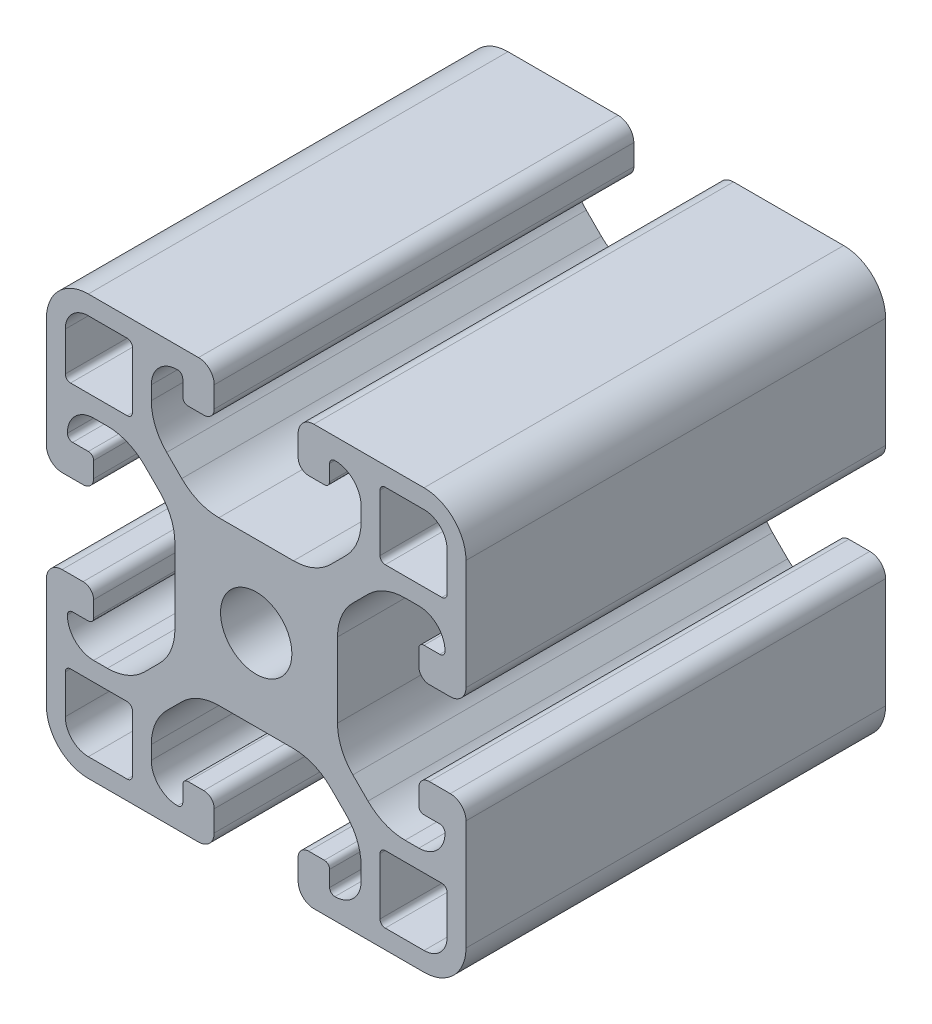
from build123d import *

# Parameters (mm, degrees)
ESQUISSE1_R        = 3.4
BOSS_EXTRU_1_DEPTH = 40


with BuildPart() as part:
    # Esquisse1 → Boss.-Extru.1 (new body)
    with BuildSketch(Plane(origin=(0, 0, -30), x_dir=(-1, 0, 0), z_dir=(0, 0, -1))):
        with BuildLine():
            Line((-4.5, 15), (-4.5, 13.5))
            ThreePointArc((-4.5, 13.5), (-4.353553391, 13.146446609), (-4, 13))
            Line((-4, 13), (-2.5, 13))
            ThreePointArc((-2.5, 13), (-2.146446609, 12.853553391), (-2, 12.5))
            ThreePointArc((-2, 12.5), (-2.732233047, 10.732233047), (-4.5, 10))
            Line((-4.5, 10), (-5.807611845, 10))
            ThreePointArc((-5.807611845, 10), (-7.721029006, 10.380602337), (-9.343145751, 11.464466094))
            Line((-9.343145751, 11.464466094), (-10.785533906, 12.906854249))
            ThreePointArc((-10.785533906, 12.906854249), (-11.869397663, 14.528970994), (-12.25, 16.442388155))
            Line((-12.25, 16.442388155), (-12.25, 23.557611845))
            ThreePointArc((-12.25, 23.557611845), (-11.869397663, 25.471029006), (-10.785533906, 27.093145751))
            Line((-10.785533906, 27.093145751), (-9.343145751, 28.535533906))
            ThreePointArc((-9.343145751, 28.535533906), (-7.721029006, 29.619397663), (-5.807611845, 30))
            Line((-5.807611845, 30), (-4.5, 30))
            ThreePointArc((-4.5, 30), (-2.732233047, 29.267766953), (-2, 27.5))
            ThreePointArc((-2, 27.5), (-2.146446609, 27.146446609), (-2.5, 27))
            Line((-2.5, 27), (-4, 27))
            ThreePointArc((-4, 27), (-4.353553391, 26.853553391), (-4.5, 26.5))
            Line((-4.5, 26.5), (-4.5, 25))
            ThreePointArc((-4.5, 25), (-4.207106781, 24.292893219), (-3.5, 24))
            Line((-3.5, 24), (-1.5, 24))
            ThreePointArc((-1.5, 24), (-0.439339828, 24.439339828), (0, 25.5))
            Line((0, 25.5), (0, 36))
            ThreePointArc((0, 36), (-1.171572875, 38.828427125), (-4, 40))
            Line((-4, 40), (-14.5, 40))
            ThreePointArc((-14.5, 40), (-15.560660172, 39.560660172), (-16, 38.5))
            Line((-16, 38.5), (-16, 36.5))
            ThreePointArc((-16, 36.5), (-15.707106781, 35.792893219), (-15, 35.5))
            Line((-15, 35.5), (-13.5, 35.5))
            ThreePointArc((-13.5, 35.5), (-13.146446609, 35.646446609), (-13, 36))
            Line((-13, 36), (-13, 37.5))
            ThreePointArc((-13, 37.5), (-12.853553391, 37.853553391), (-12.5, 38))
            ThreePointArc((-12.5, 38), (-10.732233047, 37.267766953), (-10, 35.5))
            Line((-10, 35.5), (-10, 34.192388155))
            ThreePointArc((-10, 34.192388155), (-10.380602337, 32.278970994), (-11.464466094, 30.656854249))
            Line((-11.464466094, 30.656854249), (-12.906854249, 29.214466094))
            ThreePointArc((-12.906854249, 29.214466094), (-14.528970994, 28.130602337), (-16.442388155, 27.75))
            Line((-16.442388155, 27.75), (-23.557611845, 27.75))
            ThreePointArc((-23.557611845, 27.75), (-25.471029006, 28.130602337), (-27.093145751, 29.214466094))
            Line((-27.093145751, 29.214466094), (-28.535533906, 30.656854249))
            ThreePointArc((-28.535533906, 30.656854249), (-29.619397663, 32.278970994), (-30, 34.192388155))
            Line((-30, 34.192388155), (-30, 35.5))
            ThreePointArc((-30, 35.5), (-29.267766953, 37.267766953), (-27.5, 38))
            ThreePointArc((-27.5, 38), (-27.146446609, 37.853553391), (-27, 37.5))
            Line((-27, 37.5), (-27, 36))
            ThreePointArc((-27, 36), (-26.853553391, 35.646446609), (-26.5, 35.5))
            Line((-26.5, 35.5), (-25, 35.5))
            ThreePointArc((-25, 35.5), (-24.292893219, 35.792893219), (-24, 36.5))
            Line((-24, 36.5), (-24, 38.5))
            ThreePointArc((-24, 38.5), (-24.439339828, 39.560660172), (-25.5, 40))
            Line((-25.5, 40), (-36, 40))
            ThreePointArc((-36, 40), (-38.828427125, 38.828427125), (-40, 36))
            Line((-40, 36), (-40, 25.5))
            ThreePointArc((-40, 25.5), (-39.560660172, 24.439339828), (-38.5, 24))
            Line((-38.5, 24), (-36.5, 24))
            ThreePointArc((-36.5, 24), (-35.792893219, 24.292893219), (-35.5, 25))
            Line((-35.5, 25), (-35.5, 26.5))
            ThreePointArc((-35.5, 26.5), (-35.646446609, 26.853553391), (-36, 27))
            Line((-36, 27), (-37.5, 27))
            ThreePointArc((-37.5, 27), (-37.853553391, 27.146446609), (-38, 27.5))
            ThreePointArc((-38, 27.5), (-37.267766953, 29.267766953), (-35.5, 30))
            Line((-35.5, 30), (-34.192388155, 30))
            ThreePointArc((-34.192388155, 30), (-32.278970994, 29.619397663), (-30.656854249, 28.535533906))
            Line((-30.656854249, 28.535533906), (-29.214466094, 27.093145751))
            ThreePointArc((-29.214466094, 27.093145751), (-28.130602337, 25.471029006), (-27.75, 23.557611845))
            Line((-27.75, 23.557611845), (-27.75, 16.442388155))
            ThreePointArc((-27.75, 16.442388155), (-28.130602337, 14.528970994), (-29.214466094, 12.906854249))
            Line((-29.214466094, 12.906854249), (-30.656854249, 11.464466094))
            ThreePointArc((-30.656854249, 11.464466094), (-32.278970994, 10.380602337), (-34.192388155, 10))
            Line((-34.192388155, 10), (-35.5, 10))
            ThreePointArc((-35.5, 10), (-37.267766953, 10.732233047), (-38, 12.5))
            ThreePointArc((-38, 12.5), (-37.853553391, 12.853553391), (-37.5, 13))
            Line((-37.5, 13), (-36, 13))
            ThreePointArc((-36, 13), (-35.646446609, 13.146446609), (-35.5, 13.5))
            Line((-35.5, 13.5), (-35.5, 15))
            ThreePointArc((-35.5, 15), (-35.792893219, 15.707106781), (-36.5, 16))
            Line((-36.5, 16), (-38.5, 16))
            ThreePointArc((-38.5, 16), (-39.560660172, 15.560660172), (-40, 14.5))
            Line((-40, 14.5), (-40, 4))
            ThreePointArc((-40, 4), (-38.828427125, 1.171572875), (-36, 0))
            Line((-36, 0), (-25.5, 0))
            ThreePointArc((-25.5, 0), (-24.439339828, 0.439339828), (-24, 1.5))
            Line((-24, 1.5), (-24, 3.5))
            ThreePointArc((-24, 3.5), (-24.292893219, 4.207106781), (-25, 4.5))
            Line((-25, 4.5), (-26.5, 4.5))
            ThreePointArc((-26.5, 4.5), (-26.853553391, 4.353553391), (-27, 4))
            Line((-27, 4), (-27, 2.5))
            ThreePointArc((-27, 2.5), (-27.146446609, 2.146446609), (-27.5, 2))
            ThreePointArc((-27.5, 2), (-29.267766953, 2.732233047), (-30, 4.5))
            Line((-30, 4.5), (-30, 5.807611845))
            ThreePointArc((-30, 5.807611845), (-29.619397663, 7.721029006), (-28.535533906, 9.343145751))
            Line((-28.535533906, 9.343145751), (-27.093145751, 10.785533906))
            ThreePointArc((-27.093145751, 10.785533906), (-25.471029006, 11.869397663), (-23.557611845, 12.25))
            Line((-23.557611845, 12.25), (-16.442388155, 12.25))
            ThreePointArc((-16.442388155, 12.25), (-14.528970994, 11.869397663), (-12.906854249, 10.785533906))
            Line((-12.906854249, 10.785533906), (-11.464466094, 9.343145751))
            ThreePointArc((-11.464466094, 9.343145751), (-10.380602337, 7.721029006), (-10, 5.807611845))
            Line((-10, 5.807611845), (-10, 4.5))
            ThreePointArc((-10, 4.5), (-10.732233047, 2.732233047), (-12.5, 2))
            ThreePointArc((-12.5, 2), (-12.853553391, 2.146446609), (-13, 2.5))
            Line((-13, 2.5), (-13, 4))
            ThreePointArc((-13, 4), (-13.146446609, 4.353553391), (-13.5, 4.5))
            Line((-13.5, 4.5), (-15, 4.5))
            ThreePointArc((-15, 4.5), (-15.707106781, 4.207106781), (-16, 3.5))
            Line((-16, 3.5), (-16, 1.5))
            ThreePointArc((-16, 1.5), (-15.560660172, 0.439339828), (-14.5, 0))
            Line((-14.5, 0), (-4, 0))
            ThreePointArc((-4, 0), (-1.171572875, 1.171572875), (0, 4))
            Line((0, 4), (0, 14.5))
            ThreePointArc((0, 14.5), (-0.439339828, 15.560660172), (-1.5, 16))
            Line((-1.5, 16), (-3.5, 16))
            ThreePointArc((-3.5, 16), (-4.207106781, 15.707106781), (-4.5, 15))
        make_face()
        with Locations(Location((-20, 20, 0), (0, 0, 180))):
            Circle(ESQUISSE1_R, mode=Mode.SUBTRACT)
        with BuildLine():
            Line((-4, 1.8), (-7.7, 1.8))
            ThreePointArc((-7.7, 1.8), (-8.053553391, 1.946446609), (-8.2, 2.3))
            Line((-8.2, 2.3), (-8.2, 7.7))
            ThreePointArc((-8.2, 7.7), (-8.053553391, 8.053553391), (-7.7, 8.2))
            Line((-7.7, 8.2), (-2.3, 8.2))
            ThreePointArc((-2.3, 8.2), (-1.946446609, 8.053553391), (-1.8, 7.7))
            Line((-1.8, 7.7), (-1.8, 4))
            ThreePointArc((-1.8, 4), (-2.444365081, 2.444365081), (-4, 1.8))
        make_face(mode=Mode.SUBTRACT)
        with BuildLine():
            Line((-38.2, 4), (-38.2, 7.7))
            ThreePointArc((-38.2, 7.7), (-38.053553391, 8.053553391), (-37.7, 8.2))
            Line((-37.7, 8.2), (-32.3, 8.2))
            ThreePointArc((-32.3, 8.2), (-31.946446609, 8.053553391), (-31.8, 7.7))
            Line((-31.8, 7.7), (-31.8, 2.3))
            ThreePointArc((-31.8, 2.3), (-31.946446609, 1.946446609), (-32.3, 1.8))
            Line((-32.3, 1.8), (-36, 1.8))
            ThreePointArc((-36, 1.8), (-37.555634919, 2.444365081), (-38.2, 4))
        make_face(mode=Mode.SUBTRACT)
        with BuildLine():
            Line((-36, 38.2), (-32.3, 38.2))
            ThreePointArc((-32.3, 38.2), (-31.946446609, 38.053553391), (-31.8, 37.7))
            Line((-31.8, 37.7), (-31.8, 32.3))
            ThreePointArc((-31.8, 32.3), (-31.946446609, 31.946446609), (-32.3, 31.8))
            Line((-32.3, 31.8), (-37.7, 31.8))
            ThreePointArc((-37.7, 31.8), (-38.053553391, 31.946446609), (-38.2, 32.3))
            Line((-38.2, 32.3), (-38.2, 36))
            ThreePointArc((-38.2, 36), (-37.555634919, 37.555634919), (-36, 38.2))
        make_face(mode=Mode.SUBTRACT)
        with BuildLine():
            Line((-1.8, 36), (-1.8, 32.3))
            ThreePointArc((-1.8, 32.3), (-1.946446609, 31.946446609), (-2.3, 31.8))
            Line((-2.3, 31.8), (-7.7, 31.8))
            ThreePointArc((-7.7, 31.8), (-8.053553391, 31.946446609), (-8.2, 32.3))
            Line((-8.2, 32.3), (-8.2, 37.7))
            ThreePointArc((-8.2, 37.7), (-8.053553391, 38.053553391), (-7.7, 38.2))
            Line((-7.7, 38.2), (-4, 38.2))
            ThreePointArc((-4, 38.2), (-2.444365081, 37.555634919), (-1.8, 36))
        make_face(mode=Mode.SUBTRACT)
    extrude(amount=-BOSS_EXTRU_1_DEPTH)


solid = part.part
